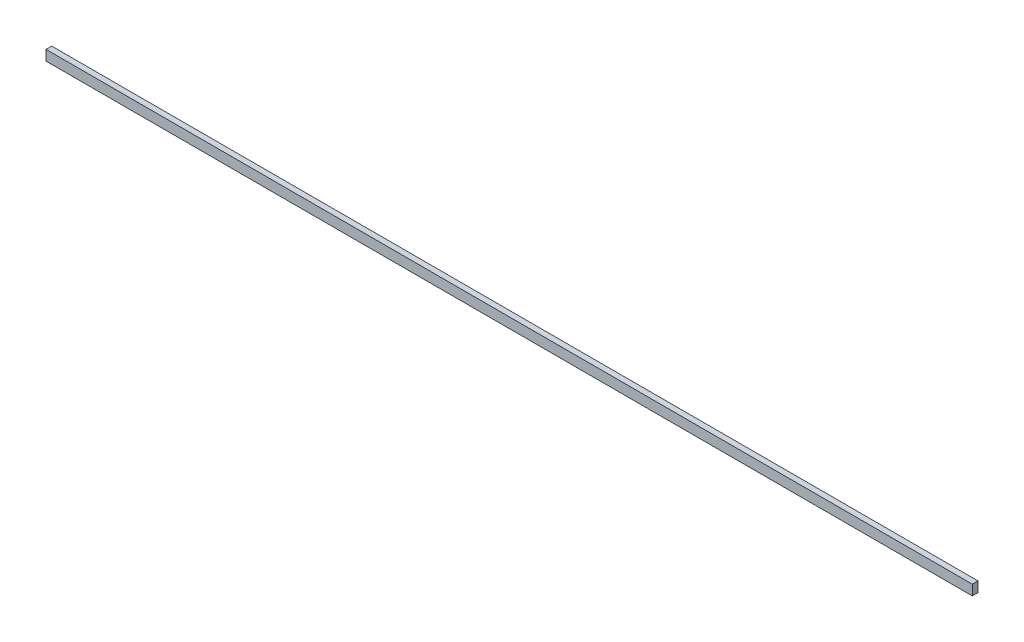
from build123d import *

# Parameters (mm, degrees)
SKETCH_2_W      = 455.6
SKETCH_2_H      = 5
EXTRUDE_1_DEPTH = 1.4


with BuildPart() as part:
    # Эскиз2 → Бобышка-Вытянуть1 (new, symmetric)
    with BuildSketch(Plane.XY):
        Rectangle(SKETCH_2_W, SKETCH_2_H)
    extrude(amount=EXTRUDE_1_DEPTH, both=True)


solid = part.part
